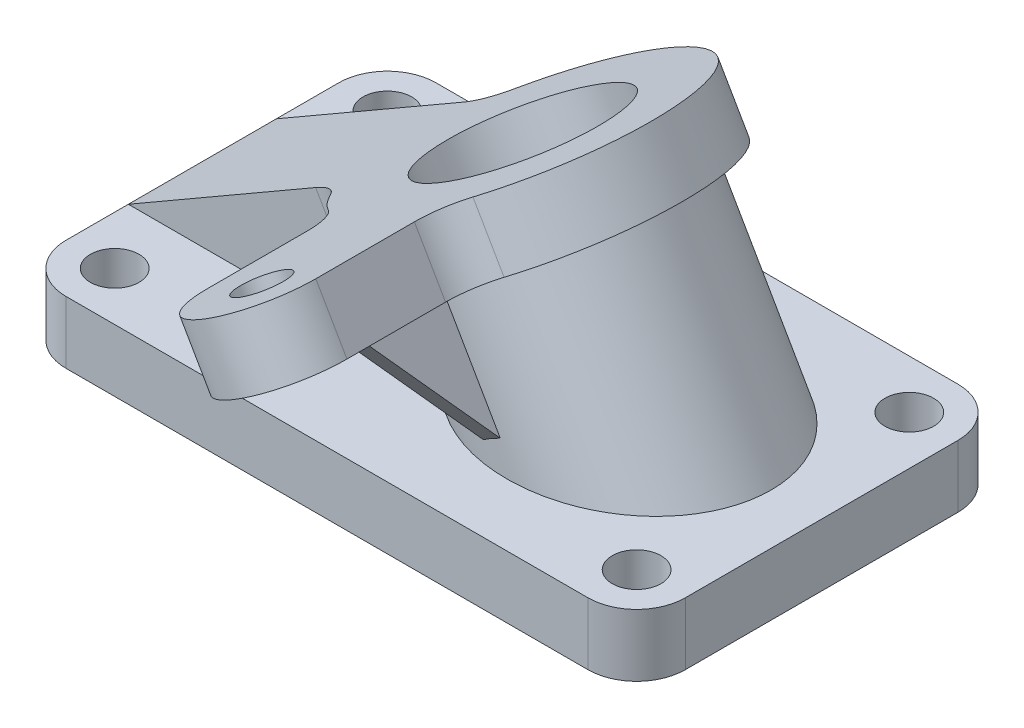
from build123d import *

# Parameters (mm, degrees)
SKETCH2_W                                 = 159
SKETCH2_H                                 = 95
BASE_EXTRUDE_DEPTH                        = 16
BOSS_EXTRUDE1_DEPTH                       = 16
BOSS_EXTRUDE2_REACH                       = 122.054
SKETCH4_R                                 = 31.5
RIB1_REACH                                = 126.027
SKETCH5_WALL_W                            = 278.31185129
SKETCH5_WALL_H                            = 13
BOSS_EXTRUDE3_DEPTH                       = 16
SKETCH7_R                                 = 6.25
CUT_EXTRUDE1_DEPTH                        = 139.006210257
FILLET1_R                                 = 12.5
CUT_EXTRUDE2_START                        = -5
CUT_EXTRUDE2_DEPTH                        = 5
RIB2_REACH                                = 153.878
SKETCH9_WALL_W                            = 345.396032214
SKETCH9_WALL_H                            = 5
CBORE_FOR_M24_HEX_HEAD_SCREW1_D           = 26
CBORE_FOR_M24_HEX_HEAD_SCREW1_CBORE_D     = 44.569
CBORE_FOR_M24_HEX_HEAD_SCREW1_CBORE_DEPTH = 15
FILLET4_R                                 = 6
CUT_EXTRUDE3_REACH                        = 143.476
SKETCH13_R                                = 6.25


with BuildPart() as part:
    # Sketch2 → Base-Extrude (new body)
    with BuildSketch(Plane(origin=(0, 0, 0), x_dir=(1, 0, 0), z_dir=(0, 1, 0))):
        Rectangle(SKETCH2_W, SKETCH2_H)
    extrude(amount=BASE_EXTRUDE_DEPTH)

    # Sketch3 → Boss-Extrude1 (add)
    with BuildSketch(Plane(origin=(-26.80320323, 46.4245098, 0), x_dir=(0, 0, -1), z_dir=(0.499999999999998, -0.8660254037844398, 0))):
        with BuildLine():
            Line((-19, -60.849019601), (-19, 1.242015055))
            ThreePointArc((-19, 1.242015055), (0, 72.150980399), (19, 1.242015055))
            Line((19, 1.242015055), (19, -60.849019601))
            Line((19, -60.849019601), (-19, -60.849019601))
        make_face()
    extrude(amount=BOSS_EXTRUDE1_DEPTH)

    # Boss-Extrude2: up to this plane
    boss_extrude2_end = Plane(origin=(-79.5, 16, -47.5), z_dir=(0, -1, 0))
    # Sketch4 → Boss-Extrude2 (add, up to the surface)
    with BuildSketch(Plane(origin=(-18.80320323, 32.56810334, 0), x_dir=(0.8660254037844398, 0.49999999999999806, 0), z_dir=(0.499999999999998, -0.8660254037844397, 0)), mode=Mode.PRIVATE) as boss_extrude2_sk1:
        with Locations(Location((34.150980399, 0, 0), (0, 0, 180))):
            Circle(SKETCH4_R)
    boss_extrude2_tool1 = split(extrude(boss_extrude2_sk1.sketch, amount=BOSS_EXTRUDE2_REACH, mode=Mode.PRIVATE), bisect_by=boss_extrude2_end, keep=Keep.BOTH, mode=Mode.PRIVATE)
    add(boss_extrude2_tool1.solids().sort_by_distance((10.772413, 49.643594, 0))[0])

    # Sketch5 wall → Rib1 (add, up to next)
    with BuildSketch(Plane(origin=(-22.439717295, 16, 0), x_dir=(1, 0, 0), z_dir=(0, 1, 0)), mode=Mode.PRIVATE) as rib1_sk1:
        Rectangle(SKETCH5_WALL_W, SKETCH5_WALL_H)
    rib1_tool1 = extrude(rib1_sk1.sketch, amount=RIB1_REACH, mode=Mode.PRIVATE) - part.part
    add(rib1_tool1.solids().sort_by_distance((-22.439717295, 16, 0))[0])

    # Sketch6 → Boss-Extrude3 (add)
    with BuildSketch(Plane(origin=(-26.80320323, 46.4245098, 0), x_dir=(-0.8660254037844398, -0.49999999999999806, 0), z_dir=(-0.499999999999998, 0.8660254037844397, 0))):
        with BuildLine():
            Line((-18.150980399, 34.467375879), (-18.150980399, 67))
            ThreePointArc((-18.150980399, 67), (-34.150980399, 83), (-50.150980399, 67))
            Line((-50.150980399, 67), (-50.150980399, 34.467375879))
            ThreePointArc((-50.150980399, 34.467375879), (-34.150980399, 38), (-18.150980399, 34.467375879))
        make_face()
    extrude(amount=-BOSS_EXTRUDE3_DEPTH)

    # Sketch7 → Cut-Extrude1 (cut, through all)
    with BuildSketch(Plane(origin=(-18.80320323, 32.56810334, 0), x_dir=(-0.8660254037844398, -0.49999999999999806, 0), z_dir=(-0.499999999999998, 0.8660254037844397, 0))):
        with Locations(Location((-34.150980399, 67, 0), (0, 0, 180))):
            Circle(SKETCH7_R)
    extrude(amount=CUT_EXTRUDE1_DEPTH, mode=Mode.SUBTRACT)

    # Fillet1
    fillet1_edges = [part.edges().sort_by_distance(p)[0] for p in [
        (-21.72758664, 40.117314098, 19),
        (-21.72758664, 40.117314098, -19),
        (20.62881982, 64.57179677, 34.467375879),
        (-7.083993101, 48.57179677, 34.467375879),
        (-79.5, 8, -47.5),
        (79.5, 8, -47.5),
        (79.5, 8, 47.5),
        (-79.5, 8, 47.5),
    ]]
    fillet(fillet1_edges, radius=FILLET1_R)

    # Sketch8 → Cut-Extrude2 (cut)
    with BuildSketch(Plane.XZ.offset(CUT_EXTRUDE2_START)):
        with BuildLine():
            Line((-51.793093674, -35), (51.793093674, -35))
            ThreePointArc((51.793093674, -35), (53.698095579, -34.317534842), (54.736365866, -32.580645161))
            ThreePointArc((54.736365866, -32.580645161), (58.161165235, -26.161165235), (64.580645161, -22.736365866))
            ThreePointArc((64.580645161, -22.736365866), (66.317534842, -21.698095579), (67, -19.793093674))
            Line((67, -19.793093674), (67, 19.793093674))
            ThreePointArc((67, 19.793093674), (66.317534842, 21.698095579), (64.580645161, 22.736365866))
            ThreePointArc((64.580645161, 22.736365866), (58.161165235, 26.161165235), (54.736365866, 32.580645161))
            ThreePointArc((54.736365866, 32.580645161), (53.698095579, 34.317534842), (51.793093674, 35))
            Line((51.793093674, 35), (-51.793093674, 35))
            ThreePointArc((-51.793093674, 35), (-53.698095579, 34.317534842), (-54.736365866, 32.580645161))
            ThreePointArc((-54.736365866, 32.580645161), (-58.161165235, 26.161165235), (-64.580645161, 22.736365866))
            ThreePointArc((-64.580645161, 22.736365866), (-66.317534842, 21.698095579), (-67, 19.793093674))
            Line((-67, 19.793093674), (-67, -19.793093674))
            ThreePointArc((-67, -19.793093674), (-66.317534842, -21.698095579), (-64.580645161, -22.736365866))
            ThreePointArc((-64.580645161, -22.736365866), (-58.161165235, -26.161165235), (-54.736365866, -32.580645161))
            ThreePointArc((-54.736365866, -32.580645161), (-53.698095579, -34.317534842), (-51.793093674, -35))
        make_face()
    extrude(amount=CUT_EXTRUDE2_DEPTH, mode=Mode.SUBTRACT)

    # Sketch9 wall → Rib2 (add, up to next)
    with BuildSketch(Plane(origin=(18.77241336, 35.787187078, 42.302042556), x_dir=(-0.40362765533, 0.699103606369, 0.590202391909), z_dir=(-0.295101195954, 0.511130264767, -0.807255310658)), mode=Mode.PRIVATE) as rib2_sk1:
        Rectangle(SKETCH9_WALL_W, SKETCH9_WALL_H)
    rib2_tool1 = extrude(rib2_sk1.sketch, amount=RIB2_REACH, mode=Mode.PRIVATE) - part.part
    add(rib2_tool1.solids().sort_by_distance((18.77241336, 35.787187078, 42.302042556))[0])

    # CBORE for M24 Hex Head Screw1 (through all)
    with Locations(Plane(origin=(-26.80320323, 46.4245098, 0), x_dir=(-0.8660254037844398, -0.49999999999999806, 0), z_dir=(-0.499999999999998, 0.8660254037844397, 0))):
        with Locations((-34.150980399, 0)):
            CounterBoreHole(CBORE_FOR_M24_HEX_HEAD_SCREW1_D / 2, CBORE_FOR_M24_HEX_HEAD_SCREW1_CBORE_D / 2, CBORE_FOR_M24_HEX_HEAD_SCREW1_CBORE_DEPTH)

    # Fillet4
    fillet4_edges = [part.edges().sort_by_distance(p)[0] for p in [
        (-47.5, 16, -12.75),
        (-47.5, 16, 12.75),
    ]]
    fillet(fillet4_edges, radius=FILLET4_R)

    # Sketch13 → Cut-Extrude3 (cut, up to next)
    with BuildSketch(Plane.XZ, mode=Mode.PRIVATE) as cut_extrude3_sk1:
        with Locations(Location((67, 35, 0), (0, 0, 270))):
            Circle(SKETCH13_R)
    cut_extrude3_tool1 = extrude(cut_extrude3_sk1.sketch, amount=-CUT_EXTRUDE3_REACH, mode=Mode.PRIVATE) & part.part
    # Sketch13 → Cut-Extrude3 (cut, up to next)
    with BuildSketch(Plane.XZ, mode=Mode.PRIVATE) as cut_extrude3_sk2:
        with Locations(Location((67, -35, 0), (0, 0, 270))):
            Circle(SKETCH13_R)
    cut_extrude3_tool2 = extrude(cut_extrude3_sk2.sketch, amount=-CUT_EXTRUDE3_REACH, mode=Mode.PRIVATE) & part.part
    # Sketch13 → Cut-Extrude3 (cut, up to next)
    with BuildSketch(Plane.XZ, mode=Mode.PRIVATE) as cut_extrude3_sk3:
        with Locations(Location((-67, -35, 0), (0, 0, 270))):
            Circle(SKETCH13_R)
    cut_extrude3_tool3 = extrude(cut_extrude3_sk3.sketch, amount=-CUT_EXTRUDE3_REACH, mode=Mode.PRIVATE) & part.part
    # Sketch13 → Cut-Extrude3 (cut, up to next)
    with BuildSketch(Plane.XZ, mode=Mode.PRIVATE) as cut_extrude3_sk4:
        with Locations(Location((-67, 35, 0), (0, 0, 270))):
            Circle(SKETCH13_R)
    cut_extrude3_tool4 = extrude(cut_extrude3_sk4.sketch, amount=-CUT_EXTRUDE3_REACH, mode=Mode.PRIVATE) & part.part
    add(cut_extrude3_tool1.solids().sort_by_distance((67, 0, 35))[0], mode=Mode.SUBTRACT)
    add(cut_extrude3_tool2.solids().sort_by_distance((67, 0, -35))[0], mode=Mode.SUBTRACT)
    add(cut_extrude3_tool3.solids().sort_by_distance((-67, 0, -35))[0], mode=Mode.SUBTRACT)
    add(cut_extrude3_tool4.solids().sort_by_distance((-67, 0, 35))[0], mode=Mode.SUBTRACT)


solid = part.part
